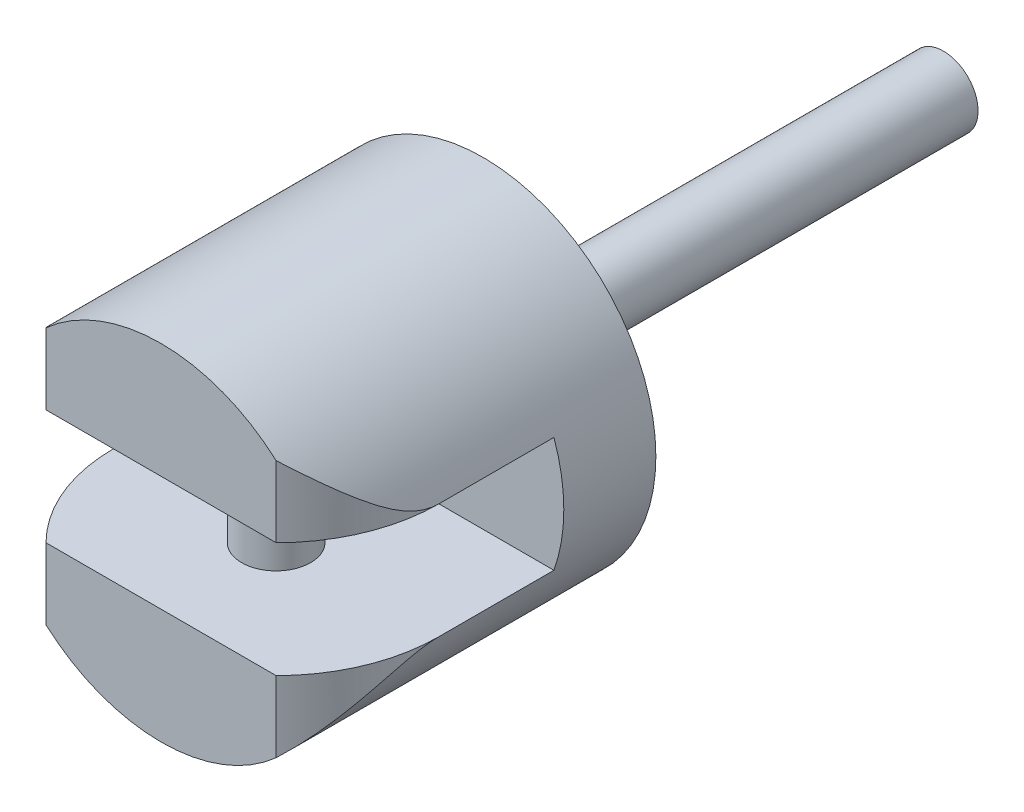
from build123d import *

# Parameters (mm, degrees)
SKETCH2_R               = 75
BOSS_EXTRUDE1_DEPTH     = 40
SKETCH3_R               = 15
BOSS_EXTRUDE2_DEPTH     = 200
BOSS_EXTRUDE3_DEPTH     = 100
SWEEP2_PROFILE_R        = 15
CUT_EXTRUDE1_DEPTH      = 227.384628453
CUT_EXTRUDE1_DEPTH_BACK = 227.384628453


with BuildPart() as part:
    # Sketch2 → Boss-Extrude1 (new body)
    with BuildSketch(Plane.XY):
        Circle(SKETCH2_R)
    extrude(amount=BOSS_EXTRUDE1_DEPTH)

    # Sketch3 → Boss-Extrude2 (add)
    with BuildSketch(Plane(origin=(0, 0, 0), x_dir=(-1, 0, 0), z_dir=(0, 0, -1))):
        Circle(SKETCH3_R)
    extrude(amount=BOSS_EXTRUDE2_DEPTH)

    # Sketch4 → Boss-Extrude3 (add)
    with BuildSketch(Plane.XY.offset(40)):
        with BuildLine():
            Line((-70.710678119, 25), (70.710678119, 25))
            ThreePointArc((70.710678119, 25), (0, 75), (-70.710678119, 25))
        make_face()
        with BuildLine():
            Line((70.710678119, -25), (-70.710678119, -25))
            ThreePointArc((-70.710678119, -25), (0, -75), (70.710678119, -25))
        make_face()
    extrude(amount=BOSS_EXTRUDE3_DEPTH)

    # Sweep2: sweep along a path in Sketch13
    with BuildLine(Plane.XY.offset(90)) as sweep2_path:
        Line((0, 25), (0, -25))
    # Sweep2 profile (on start of the path) → Sweep2 (sweep)
    with BuildSketch(Plane(origin=(0, 25, 90), x_dir=(-1, 0, 0), z_dir=(0, -1, 0))):
        Circle(SWEEP2_PROFILE_R)
    sweep(path=sweep2_path.line)

    # Sketch20 → Cut-Extrude1 (cut, two sides: drawn at the far end of the back side and taken through both)
    with BuildSketch(Plane(origin=(0, 0, 0), x_dir=(1, 0, 0), z_dir=(0, 1, 0)).offset(-CUT_EXTRUDE1_DEPTH_BACK)):
        with BuildLine():
            Line((70.710678119, -90), (70.710678119, -188.291059152))
            Line((70.710678119, -188.291059152), (-70.710678119, -188.291059152))
            Line((-70.710678119, -188.291059152), (-70.710678119, -90))
            ThreePointArc((-70.710678119, -90), (0, -160.710678119), (70.710678119, -90))
        make_face()
    extrude(amount=CUT_EXTRUDE1_DEPTH + CUT_EXTRUDE1_DEPTH_BACK, mode=Mode.SUBTRACT)


solid = part.part
